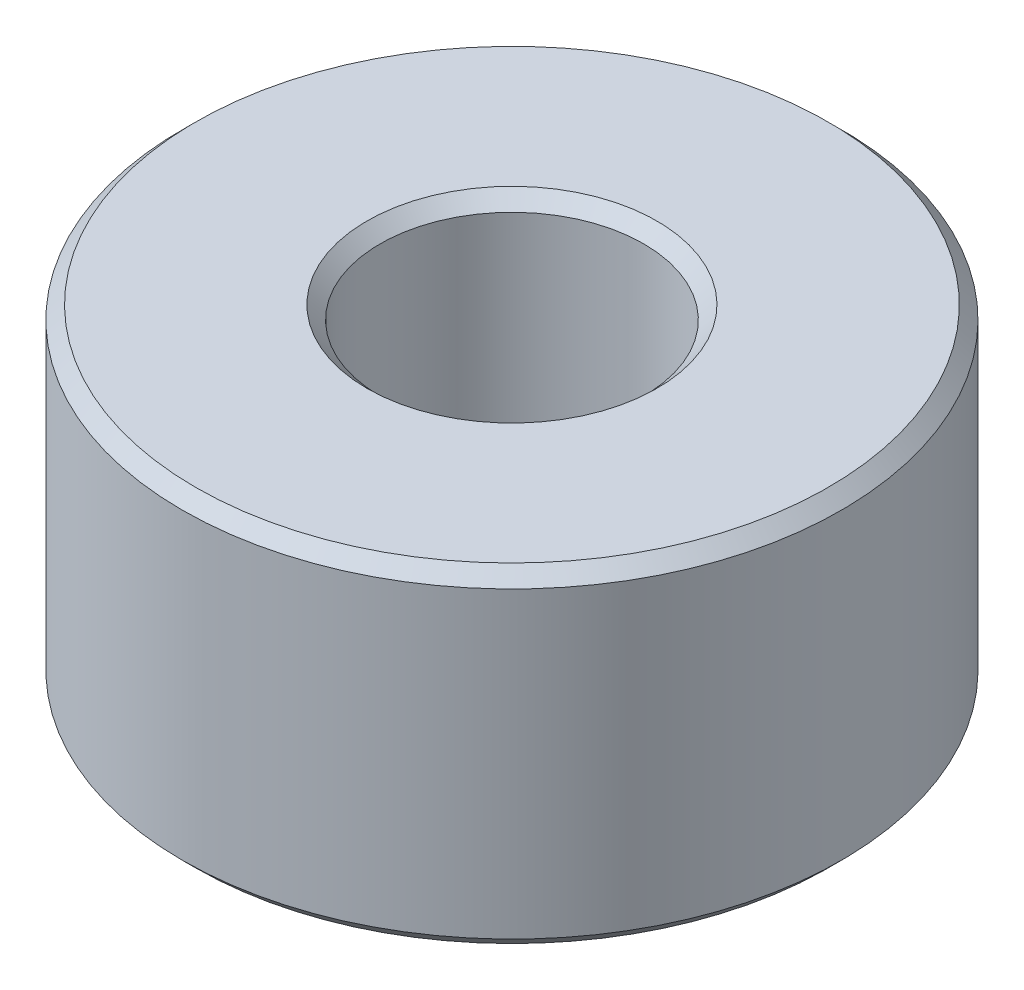
from build123d import *

# Parameters (mm, degrees)
SKETCH_1_R      = 2.5
SKETCH_1_R_2    = 1
EXTRUDE_1_DEPTH = 2.5
CHAMFER_1_SIZE  = 0.1


with BuildPart() as part:
    # 草图1 → 凸台-拉伸1 (new body)
    with BuildSketch(Plane(origin=(0, 0, 0), x_dir=(1, 0, 0), z_dir=(0, 1, 0))):
        with Locations(Location((0, 0, 0), (0, 0, 270))):
            Circle(SKETCH_1_R)
        with Locations(Location((0, 0, 0), (0, 0, 270))):
            Circle(SKETCH_1_R_2, mode=Mode.SUBTRACT)
    extrude(amount=EXTRUDE_1_DEPTH)

    # 倒角1
    chamfer_1_edges = [part.edges().sort_by_distance(p)[0] for p in [
        (0, 0, -2.5),
        (0, 2.5, -2.5),
        (0, 0, -1),
        (0, 2.5, -1),
    ]]
    chamfer(chamfer_1_edges, length=CHAMFER_1_SIZE)


solid = part.part
